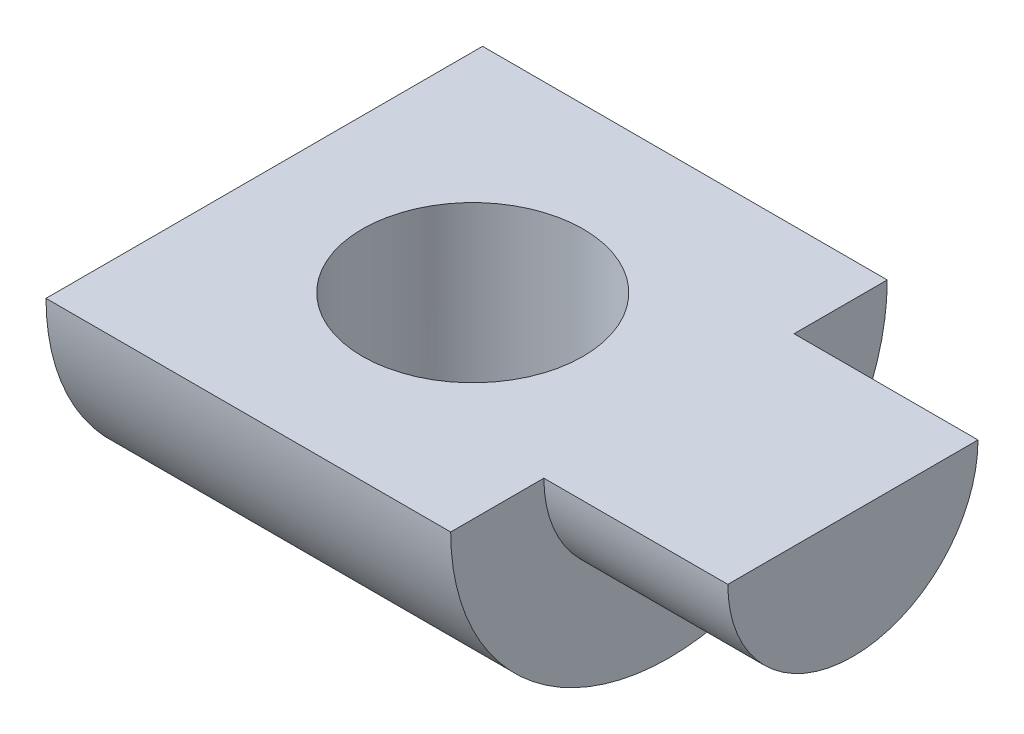
from build123d import *

# Parameters (mm, degrees)
SCHIZZO1_W                   = 165
SCHIZZO1_H                   = 178
ESTRUSIONE_ESTRUSIONE3_DEPTH = 89
TAGLIO_ESTRUSIONE1_DEPTH     = 208.525901998
ESTRUSIONE_ESTRUSIONE5_DEPTH = 75
SCHIZZO6_R                   = 45
TAGLIO_ESTRUSIONE2_DEPTH     = 174.902271406


with BuildPart() as part:
    # Schizzo1 → Estrusione-Estrusione3 (new body)
    with BuildSketch(Plane(origin=(0, 0, 0), x_dir=(1, 0, 0), z_dir=(0, 1, 0))):
        with Locations((-37.5, 0)):
            Rectangle(SCHIZZO1_W, SCHIZZO1_H)
    extrude(amount=-ESTRUSIONE_ESTRUSIONE3_DEPTH)

    # Schizzo3 → Taglio-Estrusione1 (cut, through all)
    with BuildSketch(Plane(origin=(45, 0, 0), x_dir=(0, 0, -1), z_dir=(1, 0, 0))):
        with BuildLine():
            Line((89, -89), (89, 0))
            ThreePointArc((89, 0), (62.932503523, -62.932503528), (-7e-09, -89))
            Line((-7e-09, -89), (89, -89))
        make_face()
        with BuildLine():
            ThreePointArc((-7e-09, -89), (-62.932503528, -62.932503523), (-89, 0))
            Line((-89, 0), (-89, -89))
            Line((-89, -89), (-7e-09, -89))
        make_face()
    extrude(amount=-TAGLIO_ESTRUSIONE1_DEPTH, mode=Mode.SUBTRACT)

    # Schizzo4 → Estrusione-Estrusione5 (add)
    with BuildSketch(Plane(origin=(45, 0, 0), x_dir=(0, 0, -1), z_dir=(1, 0, 0))):
        with BuildLine():
            Line((-51, 0), (51, 0))
            ThreePointArc((51, 0), (0, -51), (-51, 0))
        make_face()
    extrude(amount=ESTRUSIONE_ESTRUSIONE5_DEPTH)

    # Schizzo6 → Taglio-Estrusione2 (cut, through all)
    with BuildSketch(Plane(origin=(0, 0, 0), x_dir=(1, 0, 0), z_dir=(0, 1, 0))):
        with Locations(Location((-35, 0, 0), (0, 0, 270))):
            Circle(SCHIZZO6_R)
    extrude(amount=-TAGLIO_ESTRUSIONE2_DEPTH, mode=Mode.SUBTRACT)


solid = part.part
